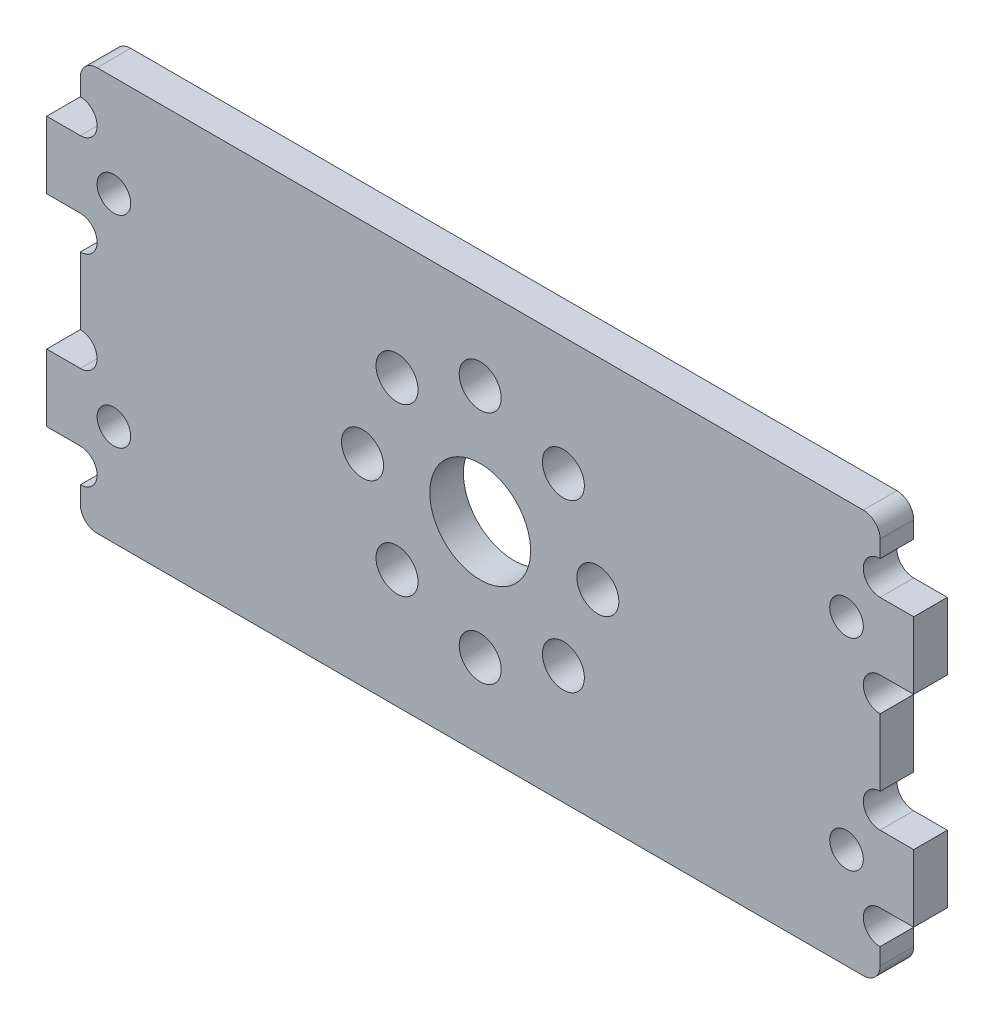
from build123d import *

# Parameters (mm, degrees)
SKETCH_1_R          = 1
EXTRUDE_2_DEPTH     = 2
SKETCH_3_R          = 1
CUT_EXTRUDE_1_DEPTH = 2
SKETCH_4_R          = 1
EXTRUDE_4_DEPTH     = 2
SKETCH_5_R          = 3
SKETCH_5_R_2        = 1.25
CUT_EXTRUDE_2_DEPTH = 2
EXTRUDE_START       = -2
SKETCH_6_R          = 1
EXTRUDE_6_DEPTH     = 2
SKETCH_7_R          = 1
CUT_EXTRUDE_3_DEPTH = 2
FILLET_3_R          = 1
FILLET_4_R          = 1
FILLET_5_R          = 1


with BuildPart() as part:
    # 草圖1 → 填料-伸長2 (new body)
    with BuildSketch(Plane.XY):
        with BuildLine():
            Line((21.259390326, 6.277522936), (21.259390326, 4.277522936))
            ThreePointArc((21.259390326, 4.277522936), (20.259390326, 3.277522936), (21.259390326, 2.277522936))
            Line((21.259390326, 2.277522936), (23.259390326, 2.277522936))
            Line((23.259390326, 2.277522936), (23.259390326, -1.722477064))
            Line((23.259390326, -1.722477064), (21.259390326, -1.722477064))
            ThreePointArc((21.259390326, -1.722477064), (20.259390326, -2.722477064), (21.259390326, -3.722477064))
            Line((21.259390326, -3.722477064), (21.259390326, -7.722477064))
            ThreePointArc((21.259390326, -7.722477064), (20.259390326, -8.722477064), (21.259390326, -9.722477064))
            Line((21.259390326, -9.722477064), (23.259390326, -9.722477064))
            Line((23.259390326, -9.722477064), (23.259390326, -13.722477064))
            Line((23.259390326, -13.722477064), (21.259390326, -13.722477064))
            ThreePointArc((21.259390326, -13.722477064), (20.259390326, -14.722477064), (21.259390326, -15.722477064))
            Line((21.259390326, -15.722477064), (21.259390326, -17.722477064))
            Line((21.259390326, -17.722477064), (-26.340609674, -17.722477064))
            Line((-26.340609674, -17.722477064), (-26.340609674, -15.722477064))
            ThreePointArc((-26.340609674, -15.722477064), (-25.340609674, -14.722477064), (-26.340609674, -13.722477064))
            Line((-26.340609674, -13.722477064), (-28.340609674, -13.722477064))
            Line((-28.340609674, -13.722477064), (-28.340609674, -9.722477064))
            Line((-28.340609674, -9.722477064), (-26.340609674, -9.722477064))
            ThreePointArc((-26.340609674, -9.722477064), (-25.340609674, -8.722477064), (-26.340609674, -7.722477064))
            Line((-26.340609674, -7.722477064), (-26.340609674, -3.722477064))
            ThreePointArc((-26.340609674, -3.722477064), (-25.340609674, -2.722477064), (-26.340609674, -1.722477064))
            Line((-26.340609674, -1.722477064), (-28.340609674, -1.722477064))
            Line((-28.340609674, -1.722477064), (-28.340609674, 2.277522936))
            Line((-28.340609674, 2.277522936), (-26.340609674, 2.277522936))
            ThreePointArc((-26.340609674, 2.277522936), (-25.340609674, 3.277522936), (-26.340609674, 4.277522936))
            Line((-26.340609674, 4.277522936), (-26.340609674, 6.277522936))
            Line((-26.340609674, 6.277522936), (21.259390326, 6.277522936))
        make_face()
        with Locations((-20.540609674, -5.722477064)):
            Circle(SKETCH_1_R, mode=Mode.SUBTRACT)
        with Locations(Location((15.459390326, -5.722477064, 0), (0, 0, 180))):
            Circle(SKETCH_1_R, mode=Mode.SUBTRACT)
    extrude(amount=EXTRUDE_2_DEPTH)

    # 草圖3 → 除料-伸長1 (cut)
    with BuildSketch(Plane.XY.offset(2)):
        with Locations((19.259390326, -5.722477064)):
            Circle(SKETCH_3_R)
        with Locations(Location((-24.340609674, -3.722477064, 0), (0, 0, 180))):
            Circle(SKETCH_3_R)
    extrude(amount=-CUT_EXTRUDE_1_DEPTH, mode=Mode.SUBTRACT)

    # 草圖4 → 填料-伸長4 (add)
    with BuildSketch(Plane(origin=(0, 0, 0), x_dir=(-1, 0, 0), z_dir=(0, 0, -1))):
        with Locations((-15.459390326, -5.722477064)):
            Circle(SKETCH_4_R)
        with Locations((20.540609674, -5.722477064)):
            Circle(SKETCH_4_R)
    extrude(amount=-EXTRUDE_4_DEPTH)

    # 草圖5 → 除料-伸長2 (cut)
    with BuildSketch(Plane(origin=(0, 0, 0), x_dir=(-1, 0, 0), z_dir=(0, 0, -1))):
        with Locations((2.540609674, -5.722477064)):
            Circle(SKETCH_5_R)
        with Locations((2.540609674, 1.277522936)):
            Circle(SKETCH_5_R_2)
        with Locations((7.490357142, -0.772729596)):
            Circle(SKETCH_5_R_2)
        with Locations((9.540609674, -5.722477064)):
            Circle(SKETCH_5_R_2)
        with Locations((7.490357142, -10.672224533)):
            Circle(SKETCH_5_R_2)
        with Locations((2.540609674, -12.722477064)):
            Circle(SKETCH_5_R_2)
        with Locations((-2.409137794, -10.672224533)):
            Circle(SKETCH_5_R_2)
        with Locations((-4.459390326, -5.722477064)):
            Circle(SKETCH_5_R_2)
        with Locations((-2.409137794, -0.772729596)):
            Circle(SKETCH_5_R_2)
    extrude(amount=-CUT_EXTRUDE_2_DEPTH, mode=Mode.SUBTRACT)

    # 草圖6 → 填料-伸長6 (add)
    with BuildSketch(Plane(origin=(0, 0, 0), x_dir=(-1, 0, 0), z_dir=(0, 0, -1)).offset(EXTRUDE_START)):
        with Locations((-19.259390326, -5.722477064)):
            Circle(SKETCH_6_R)
        with Locations((24.340609674, -3.722477064)):
            Circle(SKETCH_6_R)
    extrude(amount=EXTRUDE_6_DEPTH)

    # 草圖7 → 除料-伸長3 (cut)
    with BuildSketch(Plane(origin=(0, 0, 0), x_dir=(-1, 0, 0), z_dir=(0, 0, -1))):
        with Locations((-19.259390326, 0.277522936)):
            Circle(SKETCH_7_R)
        with Locations((-19.259390326, -11.722477064)):
            Circle(SKETCH_7_R)
        with Locations((24.340609674, -11.722477064)):
            Circle(SKETCH_7_R)
        with Locations((24.340609674, 0.277522936)):
            Circle(SKETCH_7_R)
    extrude(amount=-CUT_EXTRUDE_3_DEPTH, mode=Mode.SUBTRACT)

    # 圓角3
    fillet_3_edges = [part.edges().sort_by_distance(p)[0] for p in [
        (21.259390326, 6.277522936, 1),
    ]]
    fillet(fillet_3_edges, radius=FILLET_3_R)

    # 圓角4
    fillet_4_edges = [part.edges().sort_by_distance(p)[0] for p in [
        (21.259390326, -17.722477064, 1),
    ]]
    fillet(fillet_4_edges, radius=FILLET_4_R)

    # 圓角5
    fillet_5_edges = [part.edges().sort_by_distance(p)[0] for p in [
        (-26.340609674, 6.277522936, 1),
        (-26.340609674, -17.722477064, 1),
    ]]
    fillet(fillet_5_edges, radius=FILLET_5_R)


solid = part.part
